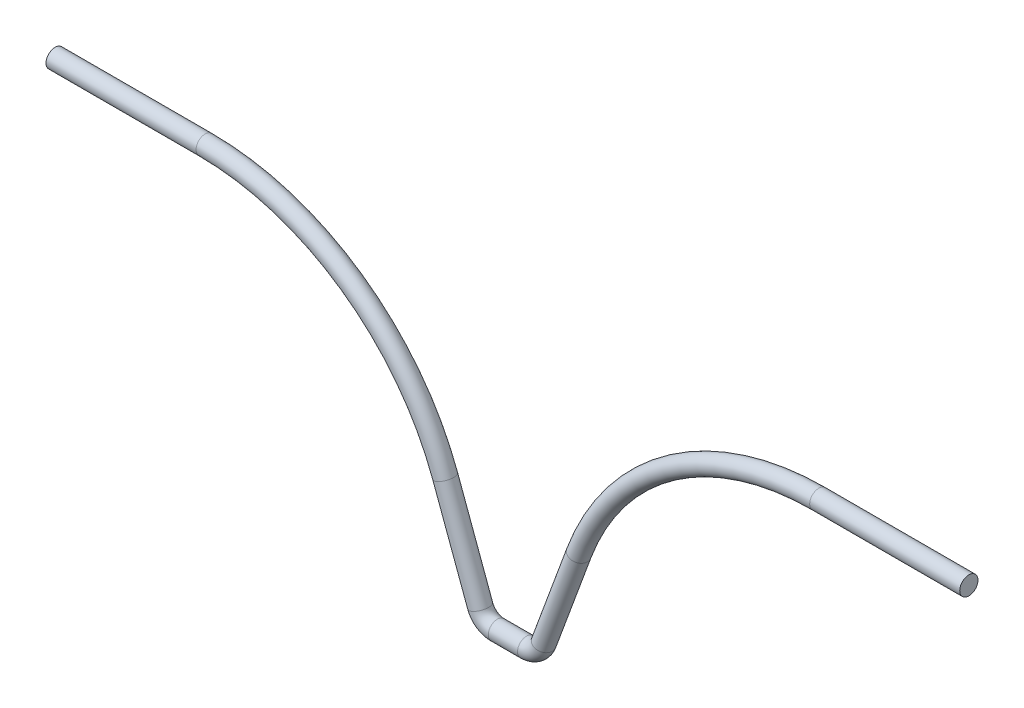
from build123d import *

# Parameters (mm, degrees)
SWEEP1_PROFILE_R = 2.5


with BuildPart() as part:
    # Sweep1: sweep along a path in Sketch1
    with BuildLine(Plane.XY) as sweep1_path:
        Line((-125, 144.352990964), (-83.945977819, 144.352990964))
        ThreePointArc((-83.945977819, 144.352990964), (-43.925617736, 131.784435128), (-18.276632803, 98.592156073))
        Line((-18.276632803, 98.592156073), (-8.690667501, 72.621622027))
        ThreePointArc((-8.690667501, 72.621622027), (-6.858597149, 70.250744952), (-4, 69.352990964))
        Line((-4, 69.352990964), (4, 69.352990964))
        ThreePointArc((4, 69.352990964), (6.858597149, 70.250744952), (8.690667501, 72.621622027))
        Line((8.690667501, 72.621622027), (18.276632803, 98.592156073))
        ThreePointArc((18.276632803, 98.592156073), (43.925617736, 131.784435128), (83.945977819, 144.352990964))
        Line((83.945977819, 144.352990964), (125, 144.352990964))
    # Sweep1 profile (on start of the path) → Sweep1 (sweep)
    with BuildSketch(Plane(origin=(-125, 144.352990964, 0), x_dir=(0, 0, 1), z_dir=(1, 0, 0))):
        Circle(SWEEP1_PROFILE_R)
    sweep(path=sweep1_path.line)


solid = part.part
